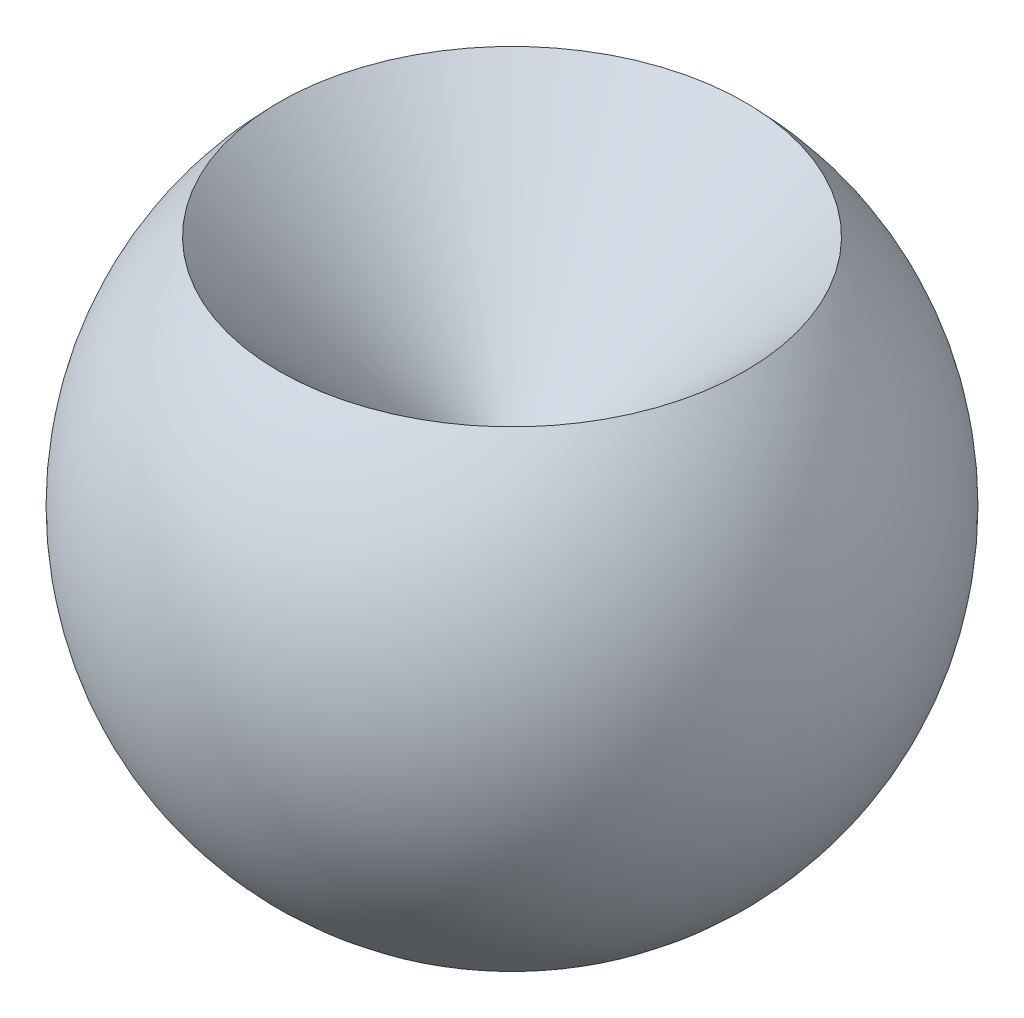
from build123d import *


with BuildPart() as part:
    # Sketch1 → Revolve1 (revolve)
    with BuildSketch(Plane.XY, mode=Mode.PRIVATE) as revolve1_sk:
        with BuildLine():
            Line((0, 0), (0, -5))
            ThreePointArc((0, -5), (4.619397663, -1.913417162), (3.535533906, 3.535533906))
            Line((3.535533906, 3.535533906), (0, 0))
        make_face()
    revolve(revolve1_sk.sketch.rotate(Axis((0, 0, 0), (0, -1, 0)), 90), axis=Axis((0, 0, 0), (0, -1, 0)))


solid = part.part
